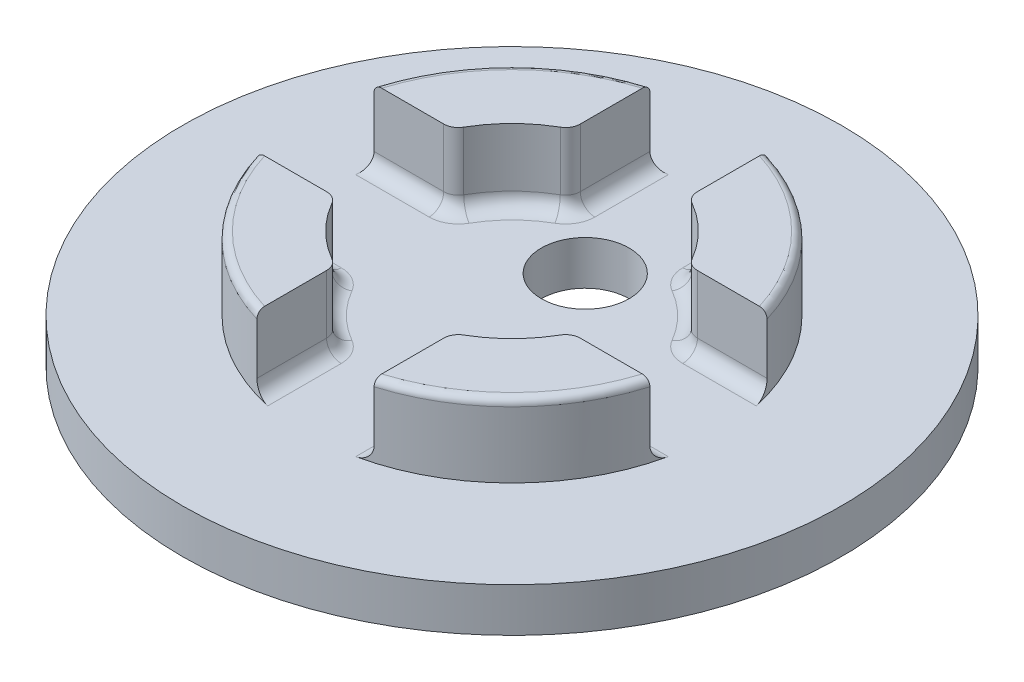
from build123d import *

# Parameters (mm, degrees)
SKETCH2_R           = 22.5
BOSS_EXTRUDE1_DEPTH = 3
BOSS_EXTRUDE2_DEPTH = 5
FILLET1_R           = 1
FILLET2_R           = 0.5
SKETCH5_R           = 3
CUT_EXTRUDE1_DEPTH  = 5


with BuildPart() as part:
    # Sketch2 → Boss-Extrude1 (new body)
    with BuildSketch(Plane(origin=(0, 0, 0), x_dir=(1, 0, 0), z_dir=(0, 1, 0))):
        with Locations(Location((0, 0, 0), (0, 0, 270))):
            Circle(SKETCH2_R)
    extrude(amount=BOSS_EXTRUDE1_DEPTH)

    # Sketch3 → Boss-Extrude2 (add)
    with BuildSketch(Plane(origin=(0, 3, 0), x_dir=(1, 0, 0), z_dir=(0, 1, 0))):
        with BuildLine():
            ThreePointArc((-4, 13.416407865), (-9.899494937, 9.899494937), (-13.416407865, 4))
            Line((-13.416407865, 4), (-8.062257748, 4))
            ThreePointArc((-8.062257748, 4), (-6.363961031, 6.363961031), (-4, 8.062257748))
            Line((-4, 8.062257748), (-4, 13.416407865))
        make_face()
        with BuildLine():
            ThreePointArc((13.416407865, 4), (9.899494937, 9.899494937), (4, 13.416407865))
            Line((4, 13.416407865), (4, 8.062257748))
            ThreePointArc((4, 8.062257748), (6.363961031, 6.363961031), (8.062257748, 4))
            Line((8.062257748, 4), (13.416407865, 4))
        make_face()
        with BuildLine():
            Line((4, -8.062257748), (4, -13.416407865))
            ThreePointArc((4, -13.416407865), (9.899494937, -9.899494937), (13.416407865, -4))
            Line((13.416407865, -4), (8.062257748, -4))
            ThreePointArc((8.062257748, -4), (6.363961031, -6.363961031), (4, -8.062257748))
        make_face()
        with BuildLine():
            Line((-8.062257748, -4), (-13.416407865, -4))
            ThreePointArc((-13.416407865, -4), (-9.899494937, -9.899494937), (-4, -13.416407865))
            Line((-4, -13.416407865), (-4, -8.062257748))
            ThreePointArc((-4, -8.062257748), (-6.363961031, -6.363961031), (-8.062257748, -4))
        make_face()
    extrude(amount=BOSS_EXTRUDE2_DEPTH)

    # Fillet1
    fillet1_edges = [part.edges().sort_by_distance(p)[0] for p in [
        (-6.363961031, 3, -6.363961031),
        (-4, 3, -10.739332807),
        (4, 5.5, -8.062257748),
        (10.739332807, 3, -4),
        (8.062257748, 5.5, -4),
        (4, 3, -10.739332807),
        (6.363961031, 3, -6.363961031),
        (8.062257748, 5.5, 4),
        (4, 3, 10.739332807),
        (4, 5.5, 8.062257748),
        (6.363961031, 3, 6.363961031),
        (10.739332807, 3, 4),
        (-4, 5.5, 8.062257748),
        (-8.062257748, 5.5, 4),
        (-6.363961031, 3, 6.363961031),
        (-4, 3, 10.739332807),
        (-10.739332807, 3, 4),
        (-8.062257748, 5.5, -4),
        (-4, 5.5, -8.062257748),
        (-10.739332807, 3, -4),
    ]]
    fillet(fillet1_edges, radius=FILLET1_R)

    # Fillet2
    fillet2_edges = [part.edges().sort_by_distance(p)[0] for p in [
        (9.899494937, 8, -9.899494937),
        (9.899494937, 8, 9.899494937),
        (-9.899494937, 8, 9.899494937),
        (-9.899494937, 8, -9.899494937),
    ]]
    fillet(fillet2_edges, radius=FILLET2_R)

    # Sketch5 → Cut-Extrude1 (cut)
    with BuildSketch(Plane(origin=(0, 3, 0), x_dir=(1, 0, 0), z_dir=(0, 1, 0))):
        with Locations(Location((0, 5, 0), (0, 0, 270))):
            Circle(SKETCH5_R)
    extrude(amount=-CUT_EXTRUDE1_DEPTH, mode=Mode.SUBTRACT)


solid = part.part
